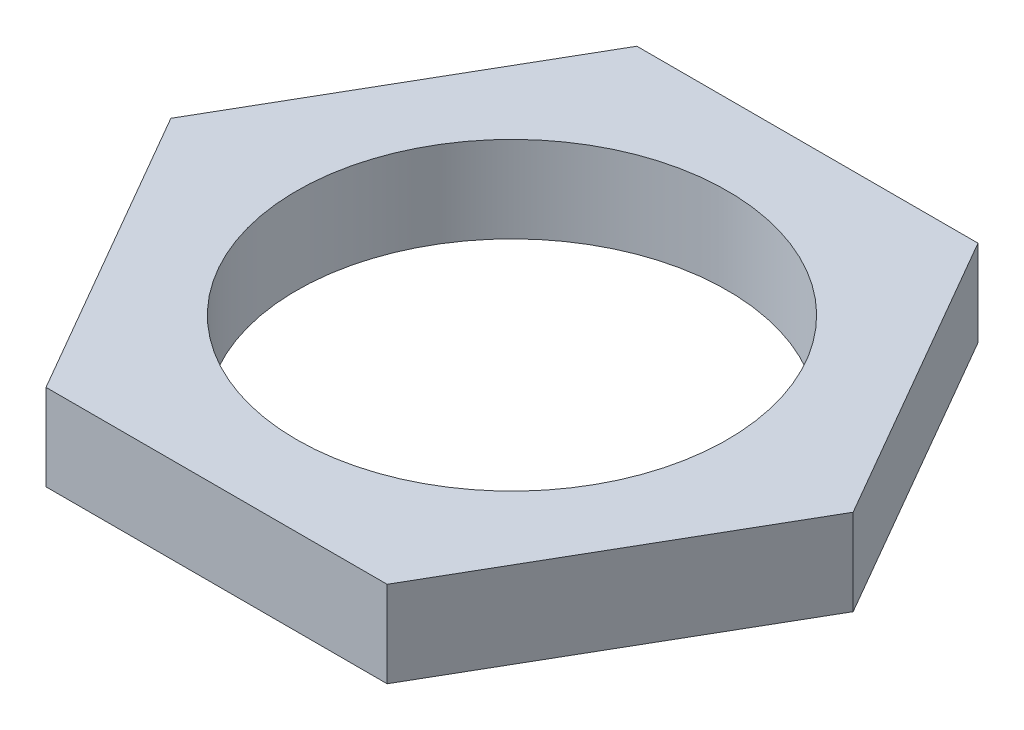
from build123d import *

# Parameters (mm, degrees)
SKETCH3_R           = 8.75
BOSS_EXTRUDE2_DEPTH = 3.5


with BuildPart() as part:
    # Sketch3 → Boss-Extrude2 (new body)
    with BuildSketch(Plane(origin=(0, 0, 0), x_dir=(1, 0, 0), z_dir=(0, 1, 0))):
        Polygon((-6.92820323, -12), (6.92820323, -12), (13.856406461, 0), (6.92820323, 12), (-6.92820323, 12), (-13.856406461, 0), align=None)
        with Locations(Location((0, 0, 0), (0, 0, 270))):
            Circle(SKETCH3_R, mode=Mode.SUBTRACT)
    extrude(amount=BOSS_EXTRUDE2_DEPTH)


solid = part.part
